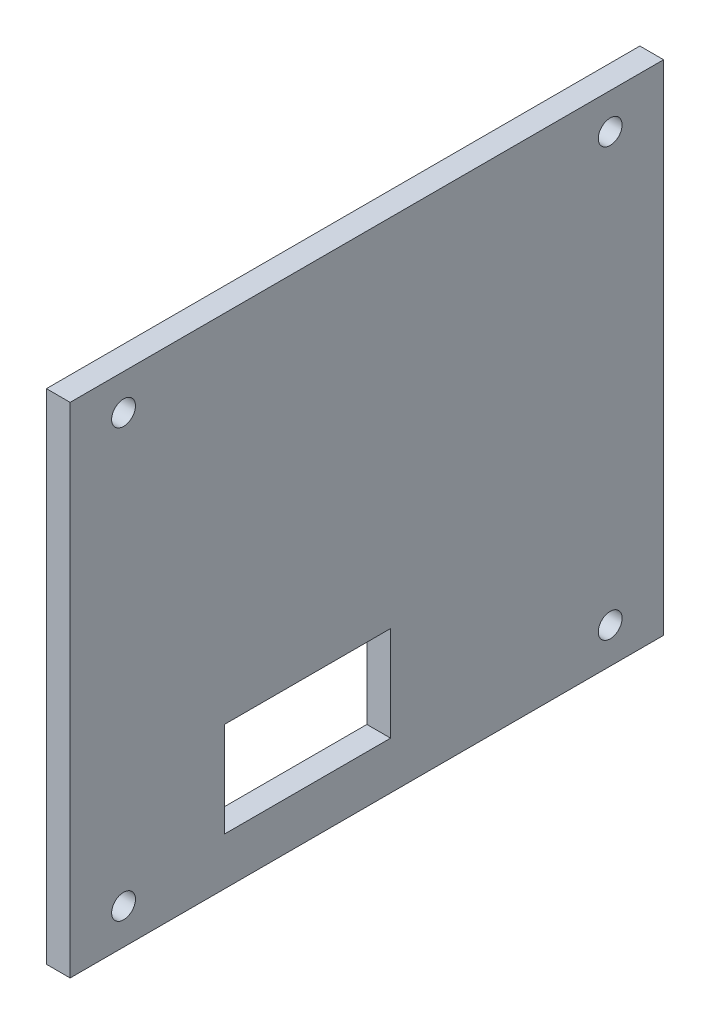
from build123d import *

# Parameters (mm, degrees)
SKETCH1_W            = 50
SKETCH1_H            = 44
BOSS_EXTRUDE1_DEPTH  = 2
SKETCH2_R            = 1.003593064
SKETCH2_W            = 14
SKETCH2_H            = 8
CUT_EXTRUDE1_DEPTH   = 2
LPATTERN1_COUNT      = 2
LPATTERN1_PITCH      = 41
LPATTERN1_COUNT_DIR2 = 2
LPATTERN1_PITCH_DIR2 = 36
SKETCH6_W            = 50
SKETCH6_H            = 0.998412165
CUT_EXTRUDE2_DEPTH   = 5
SKETCH7_W            = 50
SKETCH7_H            = 0.999196335
CUT_EXTRUDE3_DEPTH   = 5


with BuildPart() as part:
    # Sketch1 → Boss-Extrude1 (new body)
    with BuildSketch(Plane(origin=(0, 0, 0), x_dir=(0, 0, -1), z_dir=(1, 0, 0))):
        Rectangle(SKETCH1_W, SKETCH1_H)
    extrude(amount=BOSS_EXTRUDE1_DEPTH)

    # Sketch2 → Cut-Extrude1 (cut)
    with BuildSketch(Plane.ZY):
        with Locations((20.499792875, 18)):
            Circle(SKETCH2_R)
        with Locations((5, -13)):
            Rectangle(SKETCH2_W, SKETCH2_H)
    cut_extrude1 = extrude(amount=-CUT_EXTRUDE1_DEPTH, mode=Mode.SUBTRACT)

    # LPattern1: Cut-Extrude1 2 × 2
    with Locations(*[(0, -j * LPATTERN1_PITCH_DIR2, -i * LPATTERN1_PITCH) for i in range(LPATTERN1_COUNT) for j in range(LPATTERN1_COUNT_DIR2) if (i, j) != (0, 0)]):
        add(cut_extrude1, mode=Mode.SUBTRACT)

    # Sketch6 → Cut-Extrude2 (cut)
    with BuildSketch(Plane(origin=(2, 0, 0), x_dir=(0, 0, -1), z_dir=(1, 0, 0))):
        with Locations((0, 21.500793918)):
            Rectangle(SKETCH6_W, SKETCH6_H)
    extrude(amount=-CUT_EXTRUDE2_DEPTH, mode=Mode.SUBTRACT)

    # Sketch7 → Cut-Extrude3 (cut)
    with BuildSketch(Plane(origin=(2, 0, 0), x_dir=(0, 0, -1), z_dir=(1, 0, 0))):
        with Locations((0, -21.500401833)):
            Rectangle(SKETCH7_W, SKETCH7_H)
    extrude(amount=-CUT_EXTRUDE3_DEPTH, mode=Mode.SUBTRACT)


solid = part.part
